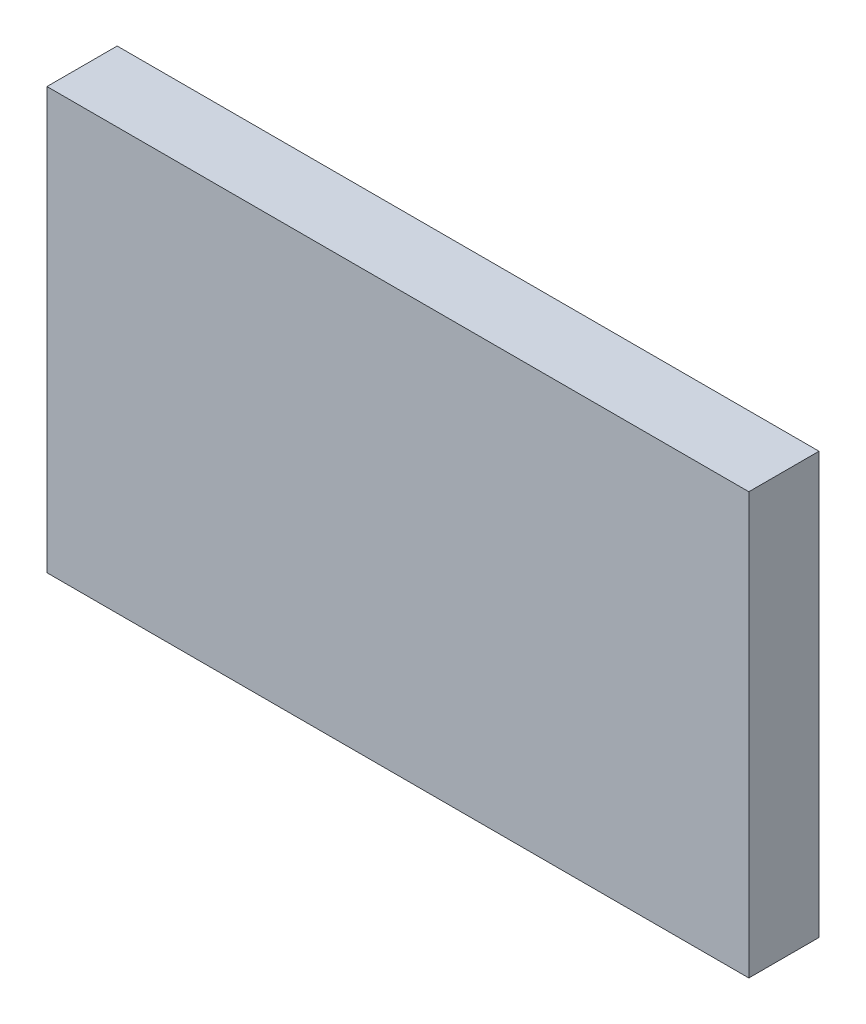
from build123d import *

# Parameters (mm, degrees)
BOSS_EXTRUDE1_DEPTH = 2


with BuildPart() as part:
    # Sketch1 → Boss-Extrude1 (new body)
    with BuildSketch(Plane.XY):
        Polygon((7.497142857, 0), (0, 0), (0, 12), (7.5, 12), (12.5, 12), (20, 12), (20, 0), (12.502857143, 0), align=None)
    extrude(amount=BOSS_EXTRUDE1_DEPTH)


solid = part.part
